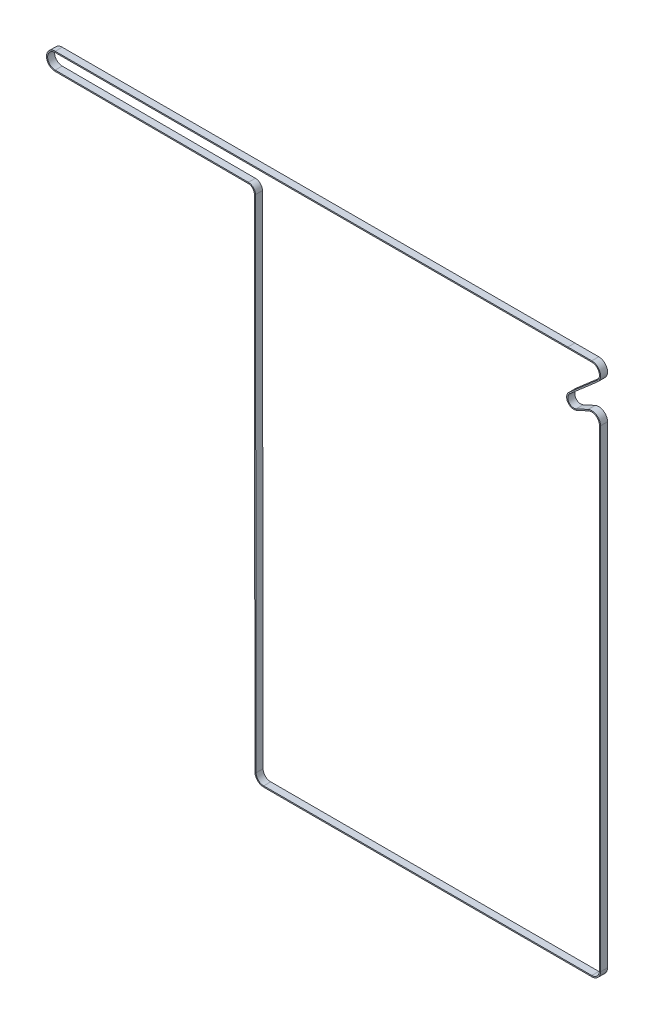
from build123d import *

# Parameters (mm, degrees)
SKETCH3_W = 6
SKETCH3_H = 1


with BuildPart() as part:
    # Sweep1: sweep along a path in Sketch2
    with BuildLine(Plane.XY) as sweep1_path:
        Line((7.533930162, -5.559792976), (17.781318169, -0.889445417))
        ThreePointArc((17.781318169, -0.889445417), (23.99309151, -1.337216564), (26.976988544, -6.803749792))
        Line((26.976988544, -6.803749792), (26.99999999, -412.150308572))
        ThreePointArc((26.99999999, -412.150308572), (25.095317263, -416.747748302), (20.497151225, -418.650676952))
        Line((20.497151225, -418.650676952), (-260.786858168, -418.527397737))
        ThreePointArc((-260.786858168, -418.527397737), (-265.378263623, -416.625531469), (-267.28400405, -412.035732696))
        Line((-267.28400405, -412.035732696), (-267.834014416, 16.920435322))
        ThreePointArc((-267.834014416, 16.920435322), (-269.61983276, 21.229266015), (-273.925552043, 23.022573168))
        Line((-273.925552043, 23.022573168), (-439.549241213, 23.522898593))
        ThreePointArc((-439.549241213, 23.522898593), (-446.029600051, 30.031464399), (-439.53205031, 36.522868475))
        Line((-439.53205031, 36.522868475), (20.497555424, 36.695880369))
        ThreePointArc((20.497555424, 36.695880369), (26.58757217, 32.474359504), (24.7659723, 25.291649968))
        Line((24.7659723, 25.291649968), (0.989986039, 4.609977009))
        ThreePointArc((0.989986039, 4.609977009), (-0.138167108, -3.306257517), (7.533930162, -5.559792976))
    # Sketch3 → Sweep1 (sweep)
    with BuildSketch(Plane(origin=(0, 0, 0), x_dir=(0, 0, -1), z_dir=(1, 0, 0))):
        with Locations((0, 37.195880369)):
            Rectangle(SKETCH3_W, SKETCH3_H)
    sweep(path=sweep1_path.line)


solid = part.part
